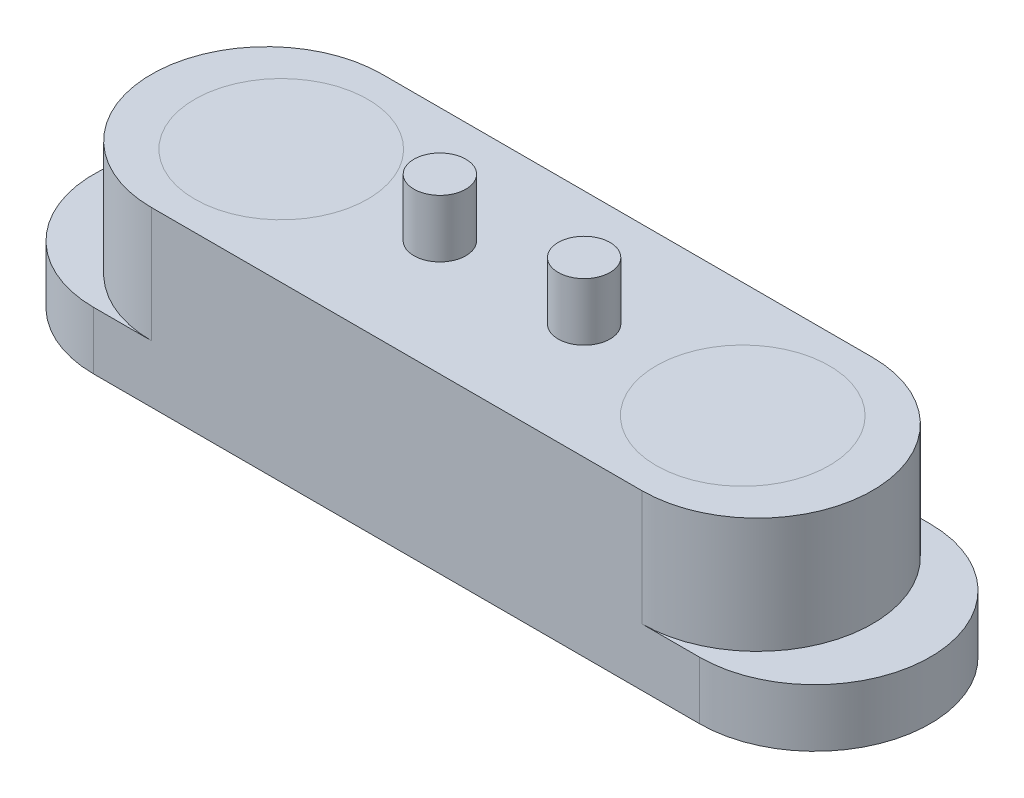
from build123d import *

# Parameters (mm, degrees)
BOSS_EXTRUDE2_DEPTH   = 1
BOSS_EXTRUDE3_DEPTH   = 2
SKETCH7_R             = 1.5
SKETCH7_R_2           = 0.45
CUT_EXTRUDE1_DEPTH    = 1
SKETCH8_R             = 1.5
BOSS_EXTRUDE4_DEPTH   = 1
BOSS_EXTRUDE4_2_DEPTH = 1
BOSS_EXTRUDE12_START  = 2
SKETCH9_R             = 0.45
BOSS_EXTRUDE12_DEPTH  = 2


with BuildPart() as part:
    # Sketch4 → Boss-Extrude2 (new body)
    with BuildSketch(Plane(origin=(0, 0, 0), x_dir=(1, 0, 0), z_dir=(0, 1, 0))):
        with BuildLine():
            Line((0, 2), (10.5, 2))
            ThreePointArc((10.5, 2), (12.5, 0), (10.5, -2))
            Line((10.5, -2), (0, -2))
            ThreePointArc((0, -2), (-2, 0), (0, 2))
        make_face()
    extrude(amount=BOSS_EXTRUDE2_DEPTH)

    # Sketch5 → Boss-Extrude3 (add)
    with BuildSketch(Plane(origin=(0, 1, 0), x_dir=(1, 0, 0), z_dir=(0, 1, 0))):
        with BuildLine():
            Line((1, 2), (9.5, 2))
            ThreePointArc((9.5, 2), (11.5, 0), (9.5, -2))
            Line((9.5, -2), (1, -2))
            ThreePointArc((1, -2), (-1, 0), (1, 2))
        make_face()
    extrude(amount=BOSS_EXTRUDE3_DEPTH)

    # Sketch7 → Cut-Extrude1 (cut)
    with BuildSketch(Plane(origin=(0, 3, 0), x_dir=(1, 0, 0), z_dir=(0, 1, 0))):
        with Locations(Location((1.25, 0, 0), (0, 0, 270))):
            Circle(SKETCH7_R)
        with Locations(Location((9.25, 0, 0), (0, 0, 270))):
            Circle(SKETCH7_R)
        with Locations(Location((4, 0, 0), (0, 0, 270))):
            Circle(SKETCH7_R_2)
        with Locations(Location((6.5, 0, 0), (0, 0, 270))):
            Circle(SKETCH7_R_2)
    extrude(amount=-CUT_EXTRUDE1_DEPTH, mode=Mode.SUBTRACT)

    # Sketch9 → Boss-Extrude12 (add)
    with BuildSketch(Plane(origin=(0, 2, 0), x_dir=(1, 0, 0), z_dir=(0, 1, 0)).offset(BOSS_EXTRUDE12_START)):
        with Locations(Location((4, 0, 0), (0, 0, 270))):
            Circle(SKETCH9_R)
        with Locations(Location((6.5, 0, 0), (0, 0, 270))):
            Circle(SKETCH9_R)
    extrude(amount=-BOSS_EXTRUDE12_DEPTH)


with BuildPart() as body_2:
    # Sketch8 → Boss-Extrude4 (new body)
    with BuildSketch(Plane(origin=(0, 2, 0), x_dir=(1, 0, 0), z_dir=(0, 1, 0))):
        with Locations(Location((1.25, 0, 0), (0, 0, 270))):
            Circle(SKETCH8_R)
    extrude(amount=BOSS_EXTRUDE4_DEPTH)


with BuildPart() as body_3:
    # Sketch8 → Boss-Extrude4 2 (new body)
    with BuildSketch(Plane(origin=(0, 2, 0), x_dir=(1, 0, 0), z_dir=(0, 1, 0))):
        with Locations(Location((9.25, 0, 0), (0, 0, 270))):
            Circle(SKETCH8_R)
    extrude(amount=BOSS_EXTRUDE4_2_DEPTH)


solid = Compound([part.part, body_2.part, body_3.part])
